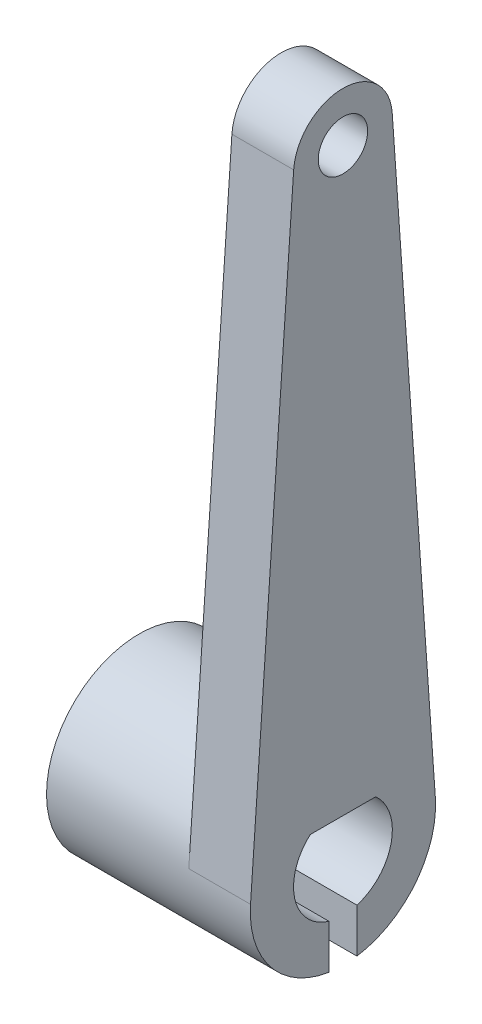
from build123d import *

# Parameters (mm, degrees)
BOSS_EXTRUDE1_DEPTH      = 2.5
BOSS_EXTRUDE1_DEPTH_BACK = 2.5
SKETCH2_R                = 2
CUT_EXTRUDE1_REACH       = 56.747
SKETCH3_W                = 2.263959938
SKETCH3_H                = 7.327028906
BOSS_EXTRUDE2_START      = 11.5
BOSS_EXTRUDE2_DEPTH      = 11.5


with BuildPart() as part:
    # Sketch2 → Boss-Extrude1 (new, two sides: drawn at the far end of the back side and taken through both)
    with BuildSketch(Plane(origin=(0, 0, 0), x_dir=(0, 0, -1), z_dir=(1, 0, 0)).offset(-BOSS_EXTRUDE1_DEPTH_BACK)):
        with BuildLine():
            Line((3.990187965, 50.28), (7.481602435, 0.525))
            ThreePointArc((7.481602435, 0.525), (0, -7.5), (-7.481602435, 0.525))
            Line((-7.481602435, 0.525), (-3.990187965, 50.28))
            ThreePointArc((-3.990187965, 50.28), (0, 54), (3.990187965, 50.28))
        make_face()
        with Locations((0, 50)):
            Circle(SKETCH2_R, mode=Mode.SUBTRACT)
        with BuildLine():
            ThreePointArc((-2.645751311, 3), (0, -4), (2.645751311, 3))
            Line((2.645751311, 3), (-2.645751311, 3))
        make_face(mode=Mode.SUBTRACT)
    extrude(amount=BOSS_EXTRUDE1_DEPTH + BOSS_EXTRUDE1_DEPTH_BACK)

    # Sketch3 → Cut-Extrude1 (cut, up to next)
    with BuildSketch(Plane(origin=(2.5, 0, 0), x_dir=(0, 0, -1), z_dir=(1, 0, 0)), mode=Mode.PRIVATE) as cut_extrude1_sk1:
        with Locations((0, -7.5)):
            Rectangle(SKETCH3_W, SKETCH3_H)
    cut_extrude1_tool1 = extrude(cut_extrude1_sk1.sketch, amount=-CUT_EXTRUDE1_REACH, mode=Mode.PRIVATE) & part.part
    add(cut_extrude1_tool1.solids().sort_by_distance((2.5, -7.5, 0))[0], mode=Mode.SUBTRACT)

    # Sketch5 → Boss-Extrude2 (add)
    with BuildSketch(Plane.ZY.offset(2.5).offset(BOSS_EXTRUDE2_START)):
        with BuildLine():
            ThreePointArc((-7.481602435, 0.525), (-5.85710754, -4.684473424), (-1.131979969, -7.414082637))
            Line((-1.131979969, -7.414082637), (-1.131979969, -3.836485547))
            ThreePointArc((-1.131979969, -3.836485547), (-3.905406133, -0.864755998), (-2.645751311, 3))
            Line((-2.645751311, 3), (2.645751311, 3))
            ThreePointArc((2.645751311, 3), (3.905406133, -0.864755998), (1.131979969, -3.836485547))
            Line((1.131979969, -3.836485547), (1.131979969, -7.414082637))
            ThreePointArc((1.131979969, -7.414082637), (5.689457345, -4.886724375), (7.5, 0))
            ThreePointArc((7.5, 0), (7.495399198, 0.262661127), (7.481602435, 0.525))
            ThreePointArc((7.481602435, 0.525), (0, 7.5), (-7.481602435, 0.525))
        make_face()
    extrude(amount=-BOSS_EXTRUDE2_DEPTH)


solid = part.part
